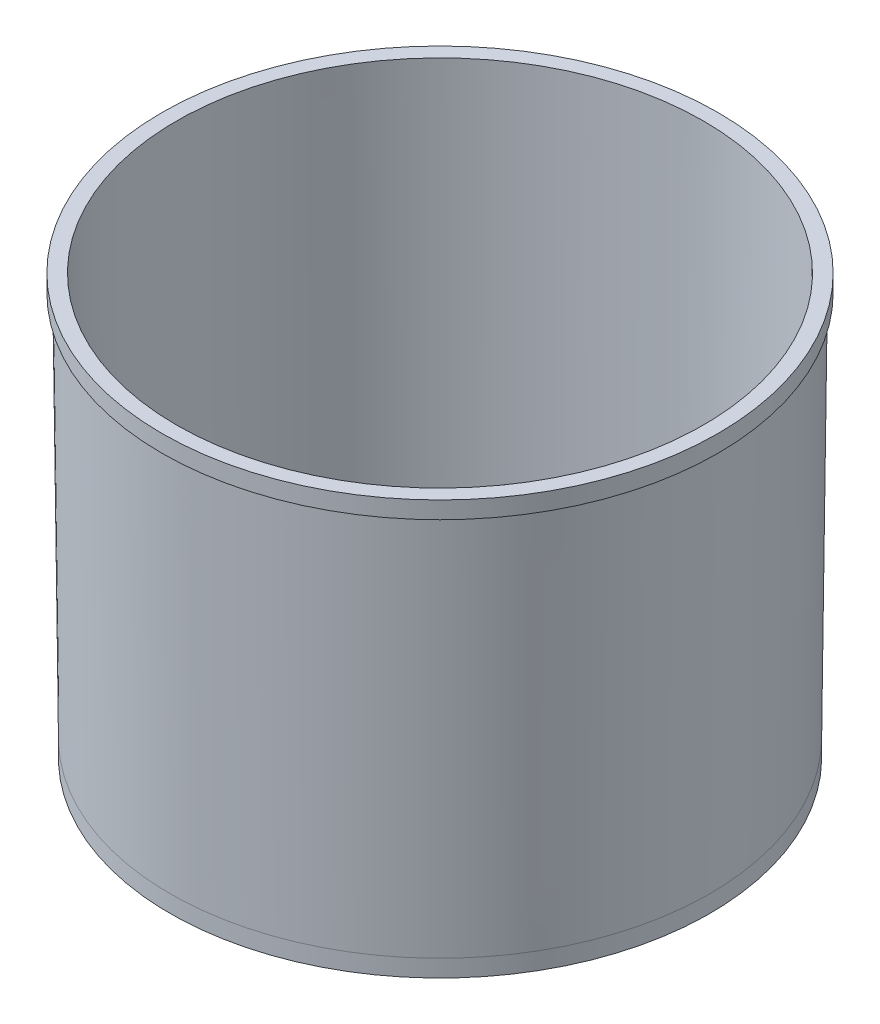
from build123d import *

# Parameters (mm, degrees)
SKETCH_2_R      = 31.5
SKETCH_2_R_2    = 30.249929249
EXTRUDE_1_DEPTH = 2


with BuildPart() as part:
    # 草图1 → 旋转1 (revolve)
    with BuildSketch(Plane.XY, mode=Mode.PRIVATE) as revolve_1_sk:
        Polygon((-31.978791145, 45), (-31.5, 0), (-30.249929249, 0), (-30.75, 47), (-32.45, 47), (-32.45, 45), align=None)
    revolve(revolve_1_sk.sketch.rotate(Axis((0, -2.4, 0), (0, 1, 0)), 270), axis=Axis((0, -2.4, 0), (0, 1, 0)))

    # 草图2 → 凸台-拉伸1 (add)
    with BuildSketch(Plane.XZ):
        with Locations(Location((0, 0, 0), (0, 0, 270))):
            Circle(SKETCH_2_R)
        with Locations(Location((0, 0, 0), (0, 0, 270))):
            Circle(SKETCH_2_R_2, mode=Mode.SUBTRACT)
    extrude(amount=EXTRUDE_1_DEPTH)


solid = part.part
